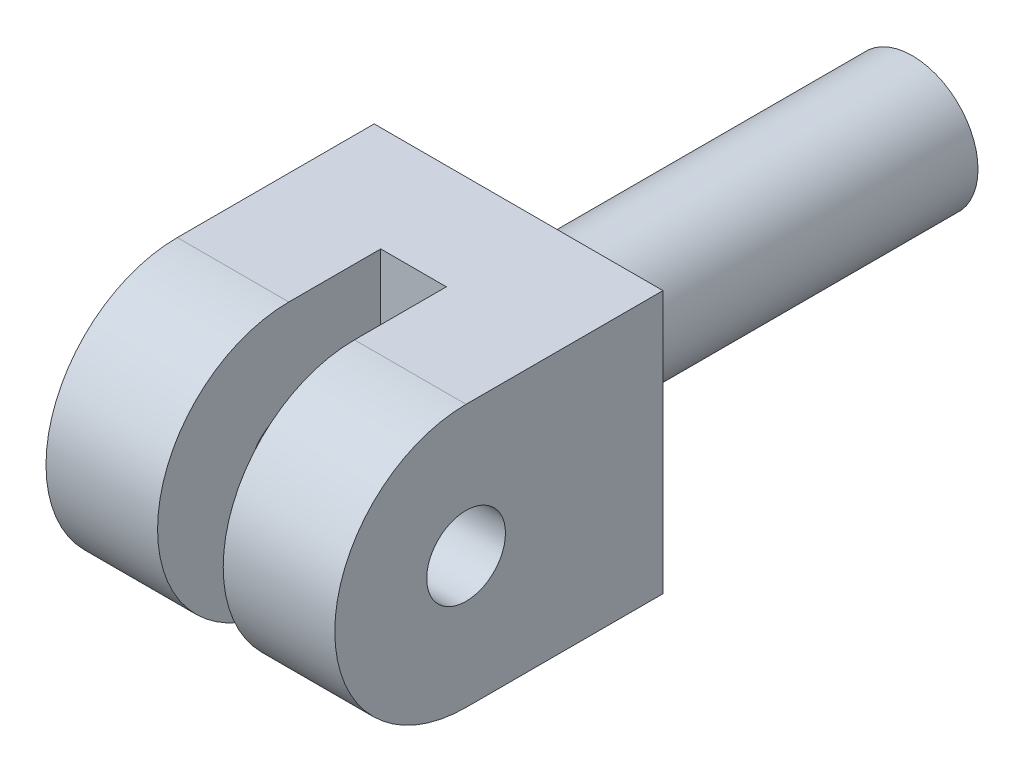
from build123d import *

# Parameters (mm, degrees)
SKETCH1_W           = 25
SKETCH1_H           = 20
BOSS_EXTRUDE1_DEPTH = 22
FILLET1_RADIUS      = 10
FILLET1_LENGTH      = 22
SKETCH2_R           = 5
BOSS_EXTRUDE2_DEPTH = 30
SKETCH3_R           = 3
CUT_EXTRUDE1_DEPTH  = 30
SKETCH4_W           = 5
SKETCH4_H           = 34
CUT_EXTRUDE2_DEPTH  = 31


with BuildPart() as part:
    # Sketch1 → Boss-Extrude1 (new body)
    with BuildSketch(Plane(origin=(0, 0, 0), x_dir=(0, 0, -1), z_dir=(1, 0, 0))):
        with Locations((12.5, 10)):
            Rectangle(SKETCH1_W, SKETCH1_H)
    extrude(amount=BOSS_EXTRUDE1_DEPTH)

    # Fillet1: full round fillet: the end face becomes a half cylinder, R = half its width
    fillet1_face = Plane((11, 10, 0), x_dir=(-1, 0, 0), z_dir=(0, 0, 1))  # on the end face: x along it, z out of the body
    fillet1_slab = fillet1_face.offset(-FILLET1_RADIUS / 2) * Box(FILLET1_LENGTH, 2 * FILLET1_RADIUS, FILLET1_RADIUS, mode=Mode.PRIVATE)  # the body's end, R deep
    fillet1_round = Plane((11, 10, -10), x_dir=(0, 0, 1), z_dir=(-1, 0, 0)) * Cylinder(FILLET1_RADIUS, FILLET1_LENGTH, mode=Mode.PRIVATE)  # its axis R under the face
    add(fillet1_slab - fillet1_round, mode=Mode.SUBTRACT)

    # Sketch2 → Boss-Extrude2 (add)
    with BuildSketch(Plane(origin=(0, 0, -25), x_dir=(-1, 0, 0), z_dir=(0, 0, -1))):
        with Locations(Location((-11, 10, 0), (0, 0, 180))):
            Circle(SKETCH2_R)
    extrude(amount=BOSS_EXTRUDE2_DEPTH)

    # Sketch3 → Cut-Extrude1 (cut)
    with BuildSketch(Plane(origin=(22, 0, 0), x_dir=(0, 0, -1), z_dir=(1, 0, 0))):
        with Locations((10, 10)):
            Circle(SKETCH3_R)
    extrude(amount=-CUT_EXTRUDE1_DEPTH, mode=Mode.SUBTRACT)

    # Sketch4 → Cut-Extrude2 (cut)
    with BuildSketch(Plane(origin=(0, 20, 0), x_dir=(1, 0, 0), z_dir=(0, 1, 0))):
        with Locations((11, 0)):
            Rectangle(SKETCH4_W, SKETCH4_H)
    extrude(amount=-CUT_EXTRUDE2_DEPTH, mode=Mode.SUBTRACT)


solid = part.part
